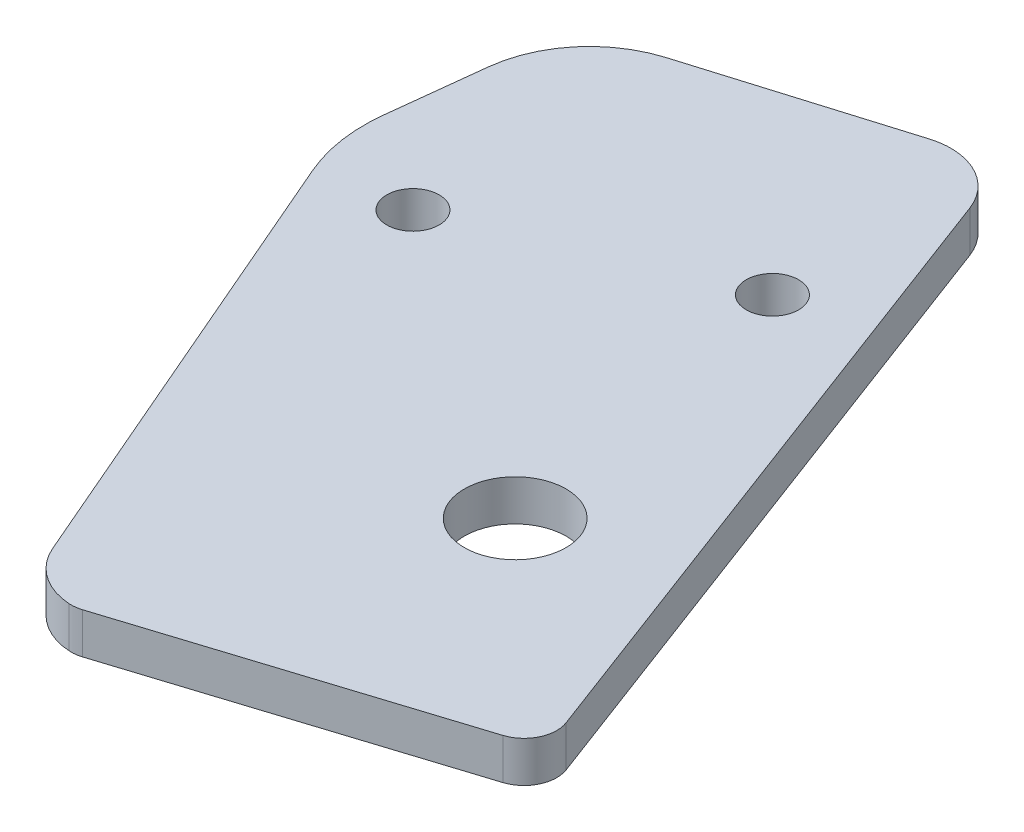
from build123d import *

# Parameters (mm, degrees)
BOSS_EXTRUDE1_DEPTH = 3.175
SKETCH2_R           = 2.032
BOSS_EXTRUDE2_DEPTH = 3.175
SKETCH2_3_R         = 3.95
CUT_EXTRUDE1_DEPTH  = 63.201892938
FILLET1_R           = 2.54


with BuildPart() as part:
    # Sketch1 → Boss-Extrude1 (new body)
    with BuildSketch(Plane(origin=(0, 0, 0), x_dir=(1, 0, 0), z_dir=(0, 1, 0))):
        Polygon((25.4, -6.35), (12.7, -6.35), (12.7, 19.05), (-12.7, 19.05), (-12.7, -19.05), (25.4, -19.05), align=None)
    extrude(amount=BOSS_EXTRUDE1_DEPTH)

    # Sketch2 → Boss-Extrude2 (add)
    # profile 1 of 2: a face of its own
    with BuildSketch(Plane.XZ):
        Polygon((12.7, 1.472649747), (13.949167892, 4.789594929), (12.7, 5.186439946), align=None)
    # profile 2 of 2: a face of its own
    with BuildSketch(Plane.XZ):
        with BuildLine():
            Line((-12.7, 13.255702289), (-13.373056837, 13.469524029))
            ThreePointArc((-13.373056837, 13.469524029), (-13.831582673, 13.569694165), (-14.300710901, 13.583790422))
            ThreePointArc((-14.300710901, 13.583790422), (-16.90590193, 12.668940106), (-18.647730427, 10.526510437))
            Line((-18.647730427, 10.526510437), (-33.997782473, -25.04377908))
            ThreePointArc((-33.997782473, -25.04377908), (-34.900150323, -28.214966504), (-34.955795775, -31.511570969))
            Line((-34.955795775, -31.511570969), (-34.123437377, -38.826910048))
            ThreePointArc((-34.123437377, -38.826910048), (-32.117046877, -43.516551498), (-27.863250656, -46.331432931))
            Line((-27.863250656, -46.331432931), (-12.15852304, -51.079668538))
            ThreePointArc((-12.15852304, -51.079668538), (-8.439878849, -50.772366449), (-5.934296975, -48.007441738))
            Line((-5.934296975, -48.007441738), (-0.611549336, -33.873823471))
            Line((-0.611549336, -33.873823471), (4.971130901, -19.05))
            Line((4.971130901, -19.05), (-12.7, -19.05))
            Line((-12.7, -19.05), (-12.7, 8.957831881))
            Line((-12.7, 8.957831881), (-12.7, 13.255702289))
        make_face()
        with Locations((-27.434824274, -26.25669415)):
            Circle(SKETCH2_R, mode=Mode.SUBTRACT)
        with Locations((-7.764936406, -34.507055205)):
            Circle(SKETCH2_R, mode=Mode.SUBTRACT)
    extrude(amount=-BOSS_EXTRUDE2_DEPTH)

    # Sketch2<3> → Cut-Extrude1 (cut, through all)
    with BuildSketch(Plane.XZ):
        Polygon((-12.7, 13.255702289), (12.7, 5.186439946), (12.7, 6.35), (25.4, 6.35), (25.4, 19.05), (-12.7, 19.05), align=None)
        Polygon((12.7, -19.05), (12.7, 1.472649747), (4.971130901, -19.05), align=None)
        with Locations((-2.723911437, -9.485123164)):
            Circle(SKETCH2_3_R)
    extrude(amount=-CUT_EXTRUDE1_DEPTH, mode=Mode.SUBTRACT)

    # Fillet1
    fillet1_edges = [part.edges().sort_by_distance(p)[0] for p in [
        (13.949167892, 1.5875, 4.789594929),
    ]]
    fillet(fillet1_edges, radius=FILLET1_R)


solid = part.part
